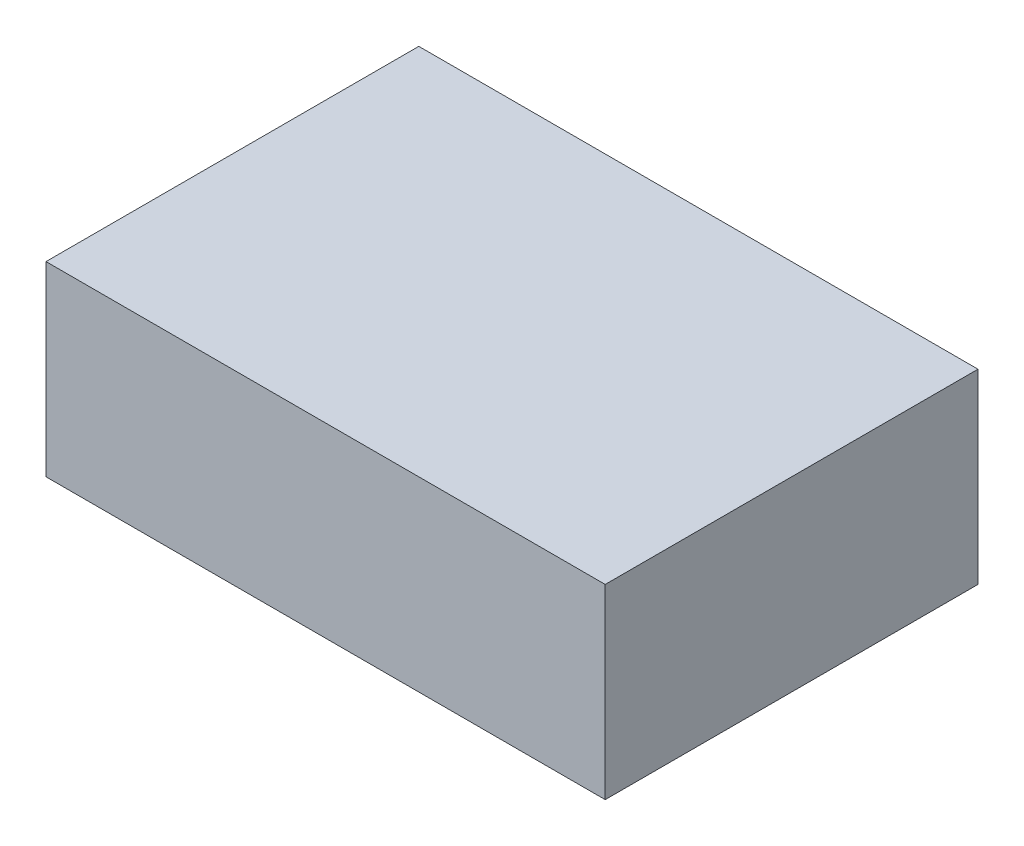
from build123d import *

# Parameters (mm, degrees)
SKETCH1_W           = 205.74
SKETCH1_H           = 137.16
BOSS_EXTRUDE1_DEPTH = 68.58


with BuildPart() as part:
    # Sketch1 → Boss-Extrude1 (new body)
    with BuildSketch(Plane(origin=(0, 0, 0), x_dir=(1, 0, 0), z_dir=(0, 1, 0))):
        with Locations((102.87, 68.58)):
            Rectangle(SKETCH1_W, SKETCH1_H)
    extrude(amount=BOSS_EXTRUDE1_DEPTH)


solid = part.part
